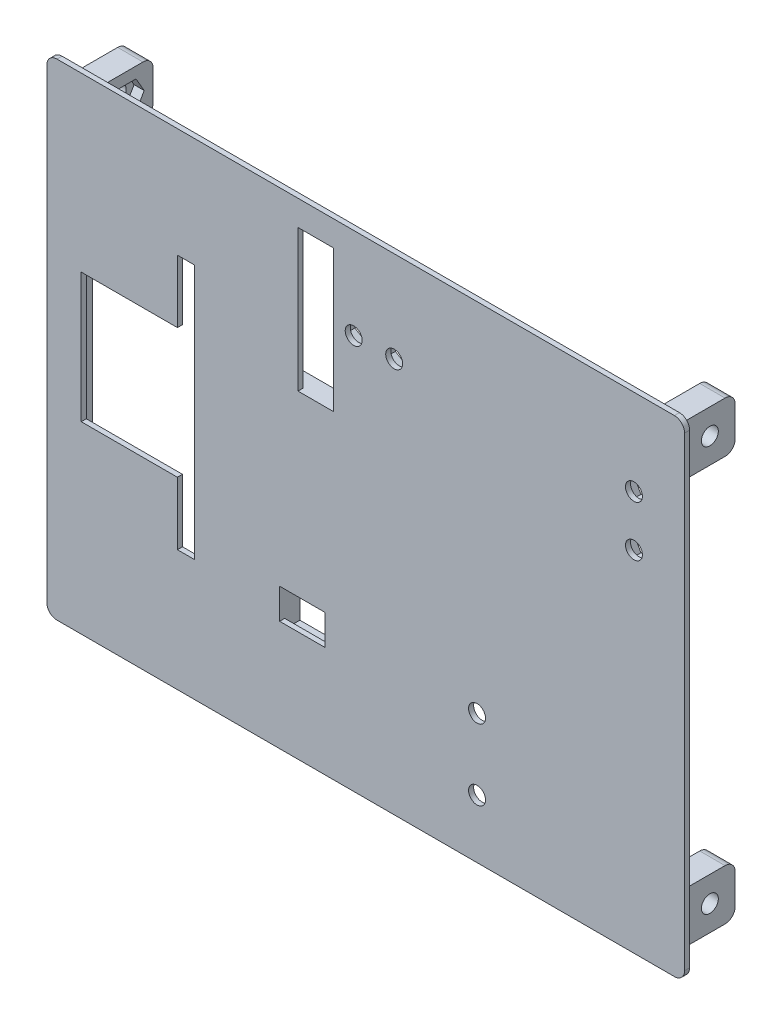
from build123d import *

# Parameters (mm, degrees)
SKETCH1_W            = 126
SKETCH1_H            = 96
SKETCH1_R            = 1.675
BOSS_EXTRUDE1_DEPTH  = 1
SKETCH2_W            = 5
SKETCH2_H            = 10
BOSS_EXTRUDE2_DEPTH  = 12
CUT_EXTRUDE1_REACH   = 134.578
SKETCH3_R            = 1.675
CUT_EXTRUDE2_START   = -2
CUT_EXTRUDE2_DEPTH   = 114.5
CHAMFER1_SIZE        = 2
CUT_EXTRUDE3_REACH   = 134.578
SKETCH5_R            = 1.675
CUT_EXTRUDE4_START   = -2
CUT_EXTRUDE4_DEPTH   = 114.5
SKETCH7_R            = 1.675
CUT_EXTRUDE5_DEPTH   = 10
SKETCH9_W            = 7
SKETCH9_H            = 28
CUT_EXTRUDE7_DEPTH   = 10
SKETCH11_R           = 1.675
SKETCH11_W           = 9
SKETCH11_H           = 6
CUT_EXTRUDE8_DEPTH   = 10
BOSS_EXTRUDE3_DEPTH  = 2
SKETCH24_W           = 19
SKETCH24_H           = 25.6
CUT_EXTRUDE17_DEPTH  = 2
FILLET1_R            = 2
SKETCH26_W           = 42.95
SKETCH26_H           = 12.988932873
SKETCH26_W_2         = 30.05
SKETCH26_H_2         = 41.011067127
SKETCH26_H_3         = 28
BOSS_EXTRUDE10_DEPTH = 3
FILLET2_R            = 2


with BuildPart() as part:
    # Sketch1 → Boss-Extrude1 (new body)
    with BuildSketch(Plane.XY):
        Rectangle(SKETCH1_W, SKETCH1_H)
        with Locations((53, 31)):
            Circle(SKETCH1_R, mode=Mode.SUBTRACT)
        with Locations((53, 21)):
            Circle(SKETCH1_R, mode=Mode.SUBTRACT)
    extrude(amount=BOSS_EXTRUDE1_DEPTH)

    # Sketch2 → Boss-Extrude2 (add)
    with BuildSketch(Plane(origin=(0, 0, 0), x_dir=(-1, 0, 0), z_dir=(0, 0, -1))):
        with Locations((-57.5, 40)):
            Rectangle(SKETCH2_W, SKETCH2_H)
        with Locations((57.5, 40)):
            Rectangle(SKETCH2_W, SKETCH2_H)
        with Locations((-57.5, -40)):
            Rectangle(SKETCH2_W, SKETCH2_H)
        with Locations((57.5, -40)):
            Rectangle(SKETCH2_W, SKETCH2_H)
    extrude(amount=BOSS_EXTRUDE2_DEPTH)

    # Cut-Extrude1: up to this face of the body (flat: up to its plane)
    cut_extrude1_end = Plane(part.part.faces().sort_by_distance((60, 40, -6))[0])
    # Sketch3 → Cut-Extrude1 (cut, up to the picked face)
    with BuildSketch(Plane.ZY.offset(60), mode=Mode.PRIVATE) as cut_extrude1_sk1:
        with Locations((-7, 40)):
            Circle(SKETCH3_R)
    cut_extrude1_tool1 = split(extrude(cut_extrude1_sk1.sketch, amount=-CUT_EXTRUDE1_REACH, mode=Mode.PRIVATE), bisect_by=cut_extrude1_end, keep=Keep.BOTH, mode=Mode.PRIVATE)
    add(cut_extrude1_tool1.solids().sort_by(Axis((-60, 40, -7), (1, 0, 0)))[0], mode=Mode.SUBTRACT)

    # Sketch4 → Cut-Extrude2 (cut)
    with BuildSketch(Plane(origin=(-55, 0, 0), x_dir=(0, 0, -1), z_dir=(1, 0, 0)).offset(CUT_EXTRUDE2_START)):
        Polygon((8.616580754, 42.8), (5.383419246, 42.8), (3.766838493, 40), (5.383419246, 37.2), (8.616580754, 37.2), (10.233161507, 40), align=None)
    extrude(amount=CUT_EXTRUDE2_DEPTH, mode=Mode.SUBTRACT)

    # Chamfer1
    chamfer1_edges = [part.edges().sort_by_distance(p)[0] for p in [
        (55, 40, 0),
        (-55, 40, 0),
        (55, -40, 0),
        (-55, -40, 0),
    ]]
    chamfer(chamfer1_edges, length=CHAMFER1_SIZE)

    # Cut-Extrude3: up to this face of the body (flat: up to its plane)
    cut_extrude3_end = Plane(part.part.faces().sort_by_distance((-60, -40, -6))[0])
    # Sketch5 → Cut-Extrude3 (cut, up to the picked face)
    with BuildSketch(Plane(origin=(60, 0, 0), x_dir=(0, 0, -1), z_dir=(1, 0, 0)), mode=Mode.PRIVATE) as cut_extrude3_sk1:
        with Locations((7, -40)):
            Circle(SKETCH5_R)
    cut_extrude3_tool1 = split(extrude(cut_extrude3_sk1.sketch, amount=-CUT_EXTRUDE3_REACH, mode=Mode.PRIVATE), bisect_by=cut_extrude3_end, keep=Keep.BOTH, mode=Mode.PRIVATE)
    add(cut_extrude3_tool1.solids().sort_by(Axis((60, -40, -7), (-1, 0, 0)))[0], mode=Mode.SUBTRACT)

    # Sketch6 → Cut-Extrude4 (cut)
    with BuildSketch(Plane(origin=(-55, 0, 0), x_dir=(0, 0, -1), z_dir=(1, 0, 0)).offset(CUT_EXTRUDE4_START)):
        Polygon((8.616580754, -37.2), (5.383419246, -37.2), (3.766838493, -40), (5.383419246, -42.8), (8.616580754, -42.8), (10.233161507, -40), align=None)
    extrude(amount=CUT_EXTRUDE4_DEPTH, mode=Mode.SUBTRACT)

    # Sketch7 → Cut-Extrude5 (cut)
    with BuildSketch(Plane.XY.offset(1)):
        with Locations((5.63, 30)):
            Circle(SKETCH7_R)
        with Locations((-2.37, 30)):
            Circle(SKETCH7_R)
    extrude(amount=-CUT_EXTRUDE5_DEPTH, mode=Mode.SUBTRACT)

    # Sketch9 → Cut-Extrude7 (cut)
    with BuildSketch(Plane.XY.offset(1)):
        with Locations((-9.87, 29)):
            Rectangle(SKETCH9_W, SKETCH9_H)
    extrude(amount=-CUT_EXTRUDE7_DEPTH, mode=Mode.SUBTRACT)

    # Sketch11 → Cut-Extrude8 (cut)
    with BuildSketch(Plane.XY.offset(1)):
        with Locations((22, -36.45)):
            Circle(SKETCH11_R)
        with Locations((22, -22.45)):
            Circle(SKETCH11_R)
        with Locations((-12.5, -23.2)):
            Rectangle(SKETCH11_W, SKETCH11_H)
    extrude(amount=-CUT_EXTRUDE8_DEPTH, mode=Mode.SUBTRACT)

    # Sketch21 → Boss-Extrude3 (add)
    # profile 1 of 4: a face of its own
    with BuildSketch(Plane(origin=(0, 0, 0), x_dir=(-1, 0, 0), z_dir=(0, 0, -1))):
        Polygon((-50.719466437, 24.95), (-55.280533563, 24.95), (-57.561067127, 21), (-55.280533563, 17.05), (-50.719466437, 17.05), (-48.438932873, 21), align=None)
        Polygon((-51.397853003, 23.775), (-54.602146997, 23.775), (-56.204293994, 21), (-54.602146997, 18.225), (-51.397853003, 18.225), (-49.795706006, 21), align=None, mode=Mode.SUBTRACT)
    # profile 2 of 4: a face of its own
    with BuildSketch(Plane(origin=(0, 0, 0), x_dir=(-1, 0, 0), z_dir=(0, 0, -1))):
        Polygon((-50.719466437, 34.95), (-55.280533563, 34.95), (-57.561067127, 31), (-55.280533563, 27.05), (-50.719466437, 27.05), (-48.438932873, 31), align=None)
        Polygon((-51.397853003, 33.775), (-54.602146997, 33.775), (-56.204293994, 31), (-54.602146997, 28.225), (-51.397853003, 28.225), (-49.795706006, 31), align=None, mode=Mode.SUBTRACT)
    # profile 3 of 4: a face of its own
    with BuildSketch(Plane(origin=(0, 0, 0), x_dir=(-1, 0, 0), z_dir=(0, 0, -1))):
        Polygon((6.32, 32.280533563), (2.37, 34.561067127), (-1.58, 32.280533563), (-1.58, 27.719466437), (2.37, 25.438932873), (6.32, 27.719466437), align=None)
        Polygon((5.145, 31.602146997), (2.37, 33.204293994), (-0.405, 31.602146997), (-0.405, 28.397853003), (2.37, 26.795706006), (5.145, 28.397853003), align=None, mode=Mode.SUBTRACT)
    # profile 4 of 4: a face of its own
    with BuildSketch(Plane(origin=(0, 0, 0), x_dir=(-1, 0, 0), z_dir=(0, 0, -1))):
        Polygon((-1.68, 32.280533563), (-5.63, 34.561067127), (-9.58, 32.280533563), (-9.58, 27.719466437), (-5.63, 25.438932873), (-1.68, 27.719466437), align=None)
        Polygon((-2.855, 31.602146997), (-5.63, 33.204293994), (-8.405, 31.602146997), (-8.405, 28.397853003), (-5.63, 26.795706006), (-2.855, 28.397853003), align=None, mode=Mode.SUBTRACT)
    extrude(amount=BOSS_EXTRUDE3_DEPTH)

    # Sketch24 → Cut-Extrude17 (cut)
    with BuildSketch(Plane.XY.offset(1)):
        with Locations((-46.7, 1.15)):
            Rectangle(SKETCH24_W, SKETCH24_H)
        Polygon((-37.2, 26.35), (-37.2, 13.95), (-37.2, -11.65), (-37.2, -24.05), (-33.8, -24.05), (-33.8, 26.35), align=None)
    extrude(amount=-CUT_EXTRUDE17_DEPTH, mode=Mode.SUBTRACT)

    # Fillet1
    fillet1_edges = [part.edges().sort_by_distance(p)[0] for p in [
        (57.5, 45, -12),
        (57.5, 35, -12),
        (-57.5, 45, -12),
        (-57.5, 35, -12),
        (57.5, -35, -12),
        (57.5, -45, -12),
        (-57.5, -35, -12),
        (-57.5, -45, -12),
    ]]
    fillet(fillet1_edges, radius=FILLET1_R)

    # Sketch26 → Boss-Extrude10 (add)
    with BuildSketch(Plane(origin=(0, 0, 0), x_dir=(-1, 0, 0), z_dir=(0, 0, -1))):
        Polygon((-27.95, -30.011067127), (-27.95, -43), (-55, -43), (-55, -45), (55, -45), (55, -43), (19, -43), (19, -30.011067127), (58, -30.011067127), (58, -35), (60, -35), (60, 35), (58, 35), (58, 32), (19, 32), (19, 43), (60, 43), (60, 45), (-60, 45), (-60, 43), (-27.95, 43), (-27.95, 15), (-58, 15), (-58, 35), (-60, 35), (-60, -35), (-58, -35), (-58, -30.011067127), align=None)
        with Locations((-4.475, -36.505533564)):
            Rectangle(SKETCH26_W, SKETCH26_H, mode=Mode.SUBTRACT)
        with Locations((-42.975, -7.505533564)):
            Rectangle(SKETCH26_W_2, SKETCH26_H_2, mode=Mode.SUBTRACT)
        with Locations((-4.475, -7.505533564)):
            Rectangle(SKETCH26_W, SKETCH26_H_2, mode=Mode.SUBTRACT)
        with Locations((-4.475, 29)):
            Rectangle(SKETCH26_W, SKETCH26_H_3, mode=Mode.SUBTRACT)
        Polygon((19, 15), (19, 30), (58, 30), (58, -28.011067127), (19, -28.011067127), (19, 13), (33.8, 13), (33.8, 15), align=None, mode=Mode.SUBTRACT)
    extrude(amount=BOSS_EXTRUDE10_DEPTH)

    # Fillet2
    fillet2_edges = [part.edges().sort_by_distance(p)[0] for p in [
        (-63, 48, 0.5),
        (63, 48, 0.5),
        (63, -48, 0.5),
        (-63, -48, 0.5),
    ]]
    fillet(fillet2_edges, radius=FILLET2_R)


solid = part.part
